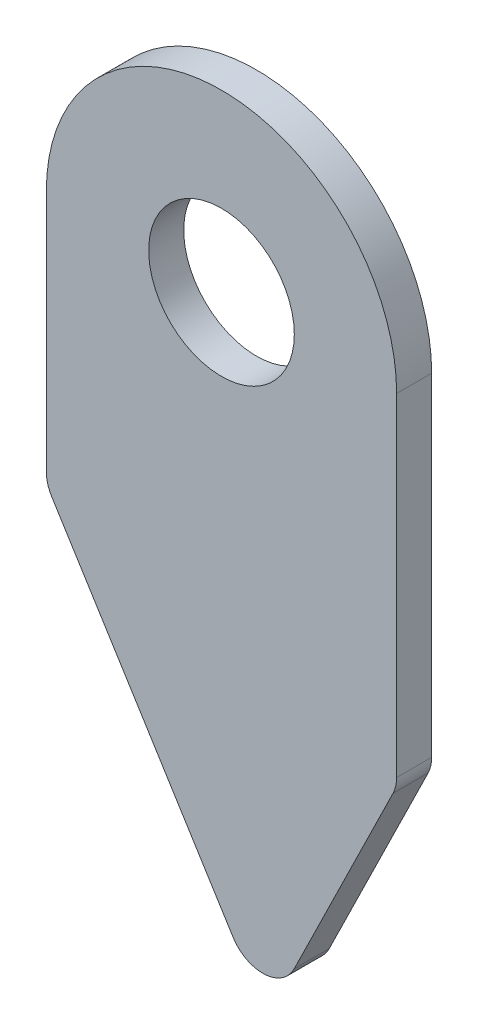
from build123d import *

# Parameters (mm, degrees)
SKETCH1_R            = 7.9375
SKETCH1_R_2          = 3
BOSS_EXTRUDE1_DEPTH  = 1.5875
M6_CLEARANCE_HOLE1_D = 6.6
CUT_EXTRUDE1_DEPTH   = 30.699405508
FILLET1_R            = 1.5875


with BuildPart() as part:
    # Sketch1 → Boss-Extrude1 (new body)
    # profile 1 of 3: a face of its own
    with BuildSketch(Plane.XY):
        Circle(SKETCH1_R)
        Circle(SKETCH1_R_2, mode=Mode.SUBTRACT)
    # profile 2 of 3: a face of its own
    with BuildSketch(Plane.XY):
        with BuildLine():
            ThreePointArc((7.9375, 0), (0, -7.9375), (-7.9375, 0))
            Line((-7.9375, 0), (-7.9375, -28.575))
            Line((-7.9375, -28.575), (7.9375, -28.575))
            Line((7.9375, -28.575), (7.9375, 0))
        make_face()
    # profile 3 of 3: a face of its own
    with BuildSketch(Plane.XY):
        Circle(SKETCH1_R_2)
    extrude(amount=BOSS_EXTRUDE1_DEPTH)

    # M6 Clearance Hole1 (through all)
    with Locations(Plane.XY.offset(1.5875)):
        with Locations((0, 0)):
            Hole(M6_CLEARANCE_HOLE1_D / 2)

    # Sketch4 → Cut-Extrude1 (cut, through all)
    with BuildSketch(Plane.XY.offset(1.5875)):
        Polygon((7.9375, -28.575), (7.9375, -15.441016157), (2.035744182, -27.468766371), (-7.9375, -11.475212377), (-7.9375, -28.575), align=None)
    extrude(amount=-CUT_EXTRUDE1_DEPTH, mode=Mode.SUBTRACT)

    # Fillet1
    fillet1_edges = [part.edges().sort_by_distance(p)[0] for p in [
        (-7.9375, -11.475212377, 0.79375),
        (2.035744182, -27.468766371, 0.79375),
        (7.9375, -15.441016157, 0.79375),
    ]]
    fillet(fillet1_edges, radius=FILLET1_R)


solid = part.part
